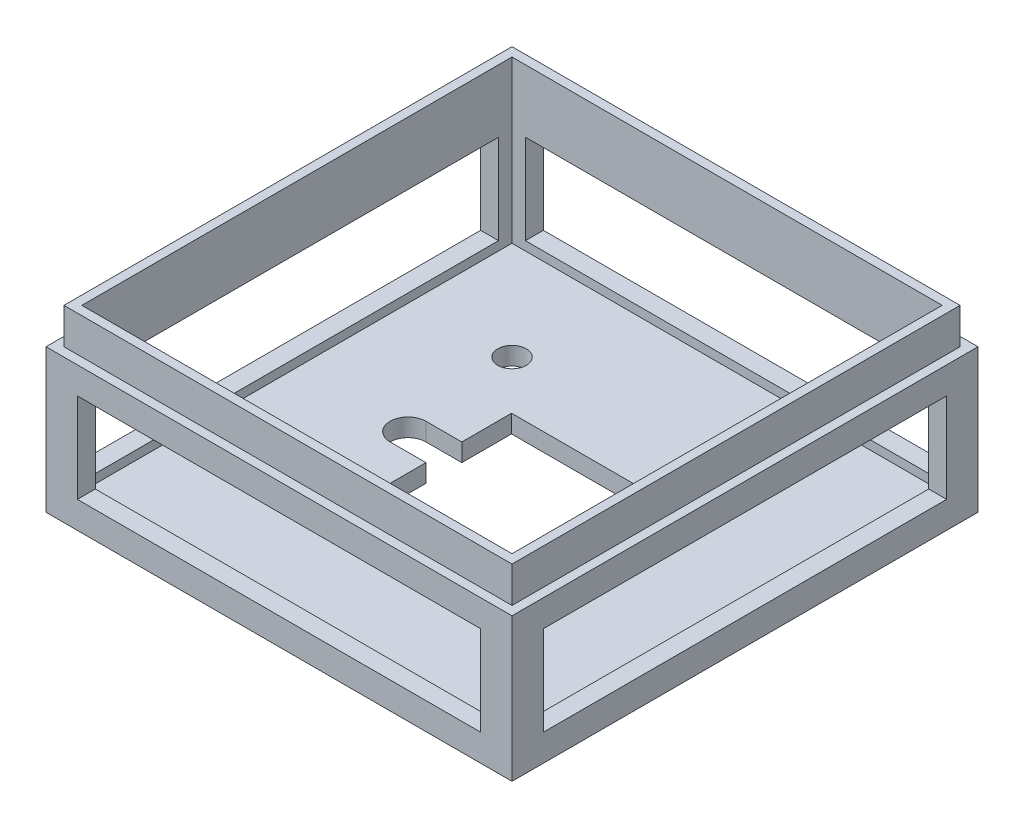
from build123d import *

# Parameters (mm, degrees)
SKETCH_1_W          = 52
SKETCH_1_H          = 52.00000000000001
SKETCH_1_W_2        = 32
SKETCH_1_H_2        = 32
SKETCH_1_R          = 1.6000000000000019
EXTRUDE_2_DEPTH     = 20
SHELL_6_T           = -2
SKETCH_3_W          = 52
SKETCH_3_H          = 52.00000000000001
SKETCH_3_W_2        = 50
SKETCH_3_H_2        = 50.00000000000001
CUT_EXTRUDE_5_DEPTH = 4
CUT_EXTRUDE_6_DEPTH = 62.4817045957576
CUT_EXTRUDE_7_DEPTH = 62.48170459575759


with BuildPart() as part:
    # 草图1 → 凸台-拉伸2 (new body)
    # profile 1 of 2: a face of its own
    with BuildSketch(Plane(origin=(0, 0, 0), x_dir=(1, 0, 0), z_dir=(0, 1, 0))):
        Rectangle(SKETCH_1_W, SKETCH_1_H)
        Rectangle(SKETCH_1_W_2, SKETCH_1_H_2, mode=Mode.SUBTRACT)
    # profile 2 of 2: a face of its own
    with BuildSketch(Plane(origin=(0, 0, 0), x_dir=(1, 0, 0), z_dir=(0, 1, 0))):
        Rectangle(SKETCH_1_W_2, SKETCH_1_H_2)
        with Locations(Location((-13.000000000000002, -13.000000000000002, 0), (0, 0, 270))):
            Circle(SKETCH_1_R, mode=Mode.SUBTRACT)
        with Locations(Location((13.000000000000009, -13.000000000000002, 0), (0, 0, 270))):
            Circle(SKETCH_1_R, mode=Mode.SUBTRACT)
        with Locations(Location((-13.000000000000002, 13.000000000000002, 0), (0, 0, 270))):
            Circle(SKETCH_1_R, mode=Mode.SUBTRACT)
        with BuildLine():
            Line((-7.599999999999996, -7.550000000000001), (-7.599999999999996, -1.9999999999999991))
            Line((-7.599999999999996, -1.9999999999999991), (-11.599999999999998, -1.9999999999999996))
            ThreePointArc((-11.599999999999998, -1.9999999999999996), (-13.599999999999998, 2.4e-16), (-11.599999999999998, 1.9999999999999996))
            Line((-11.599999999999998, 1.9999999999999996), (-7.599999999999996, 1.9999999999999991))
            Line((-7.599999999999996, 2), (-7.599999999999996, 7.549999999999999))
            Line((-7.599999999999996, 7.549999999999999), (7.600000000000003, 7.549999999999999))
            Line((7.600000000000004, 7.549999999999999), (7.600000000000004, 2))
            Line((7.600000000000002, 1.9999999999999991), (11.600000000000005, 1.9999999999999996))
            ThreePointArc((11.600000000000005, 1.9999999999999996), (13.0142135623731, 1.4142135623730947), (13.600000000000005, 0))
            ThreePointArc((13.600000000000005, -4.9e-16), (13.014213562373099, -1.4142135623730951), (11.600000000000005, -1.9999999999999996))
            Line((11.600000000000005, -1.9999999999999996), (7.600000000000002, -1.9999999999999991))
            Line((7.600000000000004, -1.9999999999999991), (7.600000000000004, -7.550000000000001))
            Line((7.600000000000003, -7.550000000000001), (-7.599999999999996, -7.550000000000001))
        make_face(mode=Mode.SUBTRACT)
        with Locations(Location((13.000000000000009, 13.000000000000002, 0), (0, 0, 270))):
            Circle(SKETCH_1_R, mode=Mode.SUBTRACT)
    extrude(amount=EXTRUDE_2_DEPTH)

    # 抽壳6
    shell_6_openings = [part.faces().sort_by_distance(p)[0] for p in [
        (-25.264608948, 20, 0),
        (-13, 10, 11.4),
        (13, 10, 11.4),
        (7.6, 10, -4.775),
        (0, 10, -7.55),
        (-7.6, 10, -4.775),
        (-9.6, 10, -2),
        (-13.6, 10, 0),
        (-9.6, 10, 2),
        (-7.6, 10, 4.775),
        (0, 10, 7.55),
        (7.6, 10, 4.775),
        (9.6, 10, 2),
        (13.6, 10, 0),
        (9.6, 10, -2),
        (-13, 10, -14.6),
        (13, 10, -14.6),
    ]]
    offset(amount=SHELL_6_T, openings=shell_6_openings, kind=Kind.INTERSECTION)

    # 草图3 → 切除-拉伸5 (cut)
    with BuildSketch(Plane(origin=(0, 20, 0), x_dir=(1, 0, 0), z_dir=(0, 1, 0))):
        Rectangle(SKETCH_3_W, SKETCH_3_H)
        Rectangle(SKETCH_3_W_2, SKETCH_3_H_2, mode=Mode.SUBTRACT)
    extrude(amount=-CUT_EXTRUDE_5_DEPTH, mode=Mode.SUBTRACT)

    # 草图4 → 切除-拉伸6 (cut, through all)
    with BuildSketch(Plane.XY.offset(26.000000000000004)):
        Polygon((22.499999999999993, 3.0000000000000044), (-22.500000000000007, 2.999999999999999), (-22.500000000000007, 13), (22.499999999999993, 13.000000000000007), align=None)
    extrude(amount=-CUT_EXTRUDE_6_DEPTH, mode=Mode.SUBTRACT)

    # 草图5 → 切除-拉伸7 (cut, through all)
    with BuildSketch(Plane.ZY.offset(25.999999999999996)):
        Polygon((0, 8), (0, 13), (-22.500000000000007, 12.999999999999996), (-22.500000000000007, 8), align=None)
        Polygon((22.499999999999993, 13.000000000000004), (0, 13), (0, 8), (22.499999999999996, 8), align=None)
        Polygon((22.499999999999996, 8), (0, 8), (0, 2.9999999999999982), (22.499999999999993, 3.000000000000001), align=None)
        Polygon((0, 2.9999999999999982), (0, 8), (-22.500000000000007, 8), (-22.500000000000007, 2.9999999999999956), align=None)
    extrude(amount=-CUT_EXTRUDE_7_DEPTH, mode=Mode.SUBTRACT)


solid = part.part
